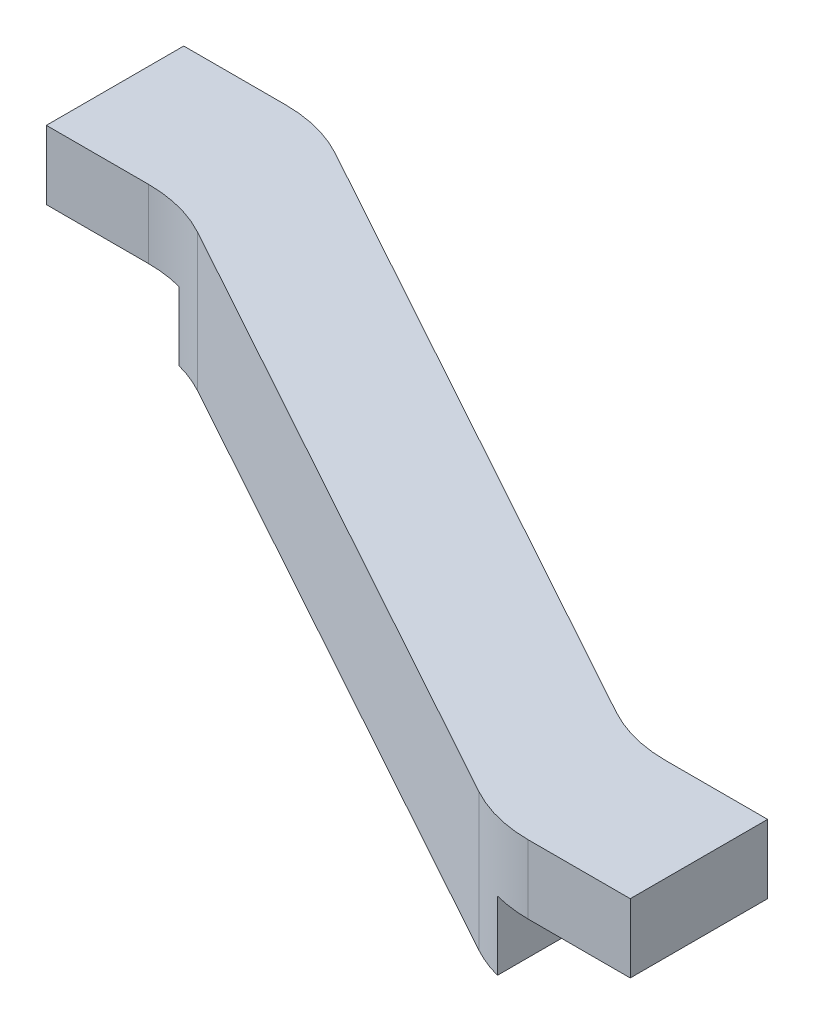
from build123d import *

# Parameters (mm, degrees)
SALIENTE_EXTRUIR1_DEPTH = 20
REDONDEO1_R             = 20
CROQUIS3_W              = 20
CROQUIS3_H              = 22.736865604
CROQUIS3_H_2            = 22.452131832
CORTAR_EXTRUIR2_DEPTH   = 10


with BuildPart() as part:
    # Croquis1 → Saliente-Extruir1 (new body)
    with BuildSketch(Plane(origin=(0, 0, 0), x_dir=(1, 0, 0), z_dir=(0, 1, 0))):
        Polygon((-70, 0), (-50, 0), (50, -55), (70, -55), (70, -75), (50, -75), (-50, -20), (-70, -20), align=None)
    extrude(amount=SALIENTE_EXTRUIR1_DEPTH)

    # Redondeo1
    redondeo1_edges = [part.edges().sort_by_distance(p)[0] for p in [
        (-50, 10, 0),
        (50, 10, 55),
        (50, 10, 75),
        (-50, 10, 20),
    ]]
    fillet(redondeo1_edges, radius=REDONDEO1_R)

    # Croquis3 → Cortar-Extruir2 (cut)
    with BuildSketch(Plane(origin=(0, 0, 0), x_dir=(1, 0, 0), z_dir=(0, 1, 0))):
        with Locations((-60, -11.368432802)):
            Rectangle(CROQUIS3_W, CROQUIS3_H)
        with Locations((60, -63.773934084)):
            Rectangle(CROQUIS3_W, CROQUIS3_H_2)
    extrude(amount=CORTAR_EXTRUIR2_DEPTH, mode=Mode.SUBTRACT)


solid = part.part
